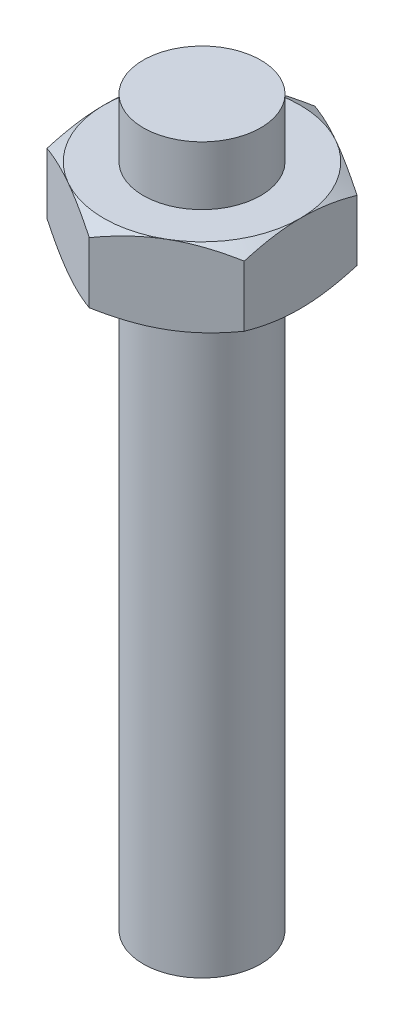
from build123d import *

# Parameters (mm, degrees)
BOSS_EXTRUDE1_DEPTH = 4
SKETCH2_OUTSIDE_W   = 29.082
SKETCH2_OUTSIDE_H   = 30.606
SKETCH2_OUTSIDE_R   = 5.014305997
CUT_EXTRUDE1_DEPTH  = 4
CUT_EXTRUDE1_DRAFT  = -60
SKETCH3_OUTSIDE_W   = 29.082
SKETCH3_OUTSIDE_H   = 30.606
SKETCH3_OUTSIDE_R   = 5.014305997
CUT_EXTRUDE2_DEPTH  = 4
CUT_EXTRUDE2_DRAFT  = -60
SKETCH4_R           = 3
BOSS_EXTRUDE3_DEPTH = 3
BOSS_EXTRUDE4_START = 30
SKETCH5_R           = 3
BOSS_EXTRUDE4_DEPTH = 30


with BuildPart() as part:
    # Sketch1 → Boss-Extrude1 (new body)
    with BuildSketch(Plane(origin=(0, 0, 0), x_dir=(1, 0, 0), z_dir=(0, 1, 0))):
        Polygon((5, 2.919649438), (-0.028490583, 5.789951738), (-5.028490583, 2.8703023), (-5, -2.919649438), (0.028490583, -5.789951738), (5.028490583, -2.8703023), align=None)
    extrude(amount=BOSS_EXTRUDE1_DEPTH)


with BuildPart() as cut_extrude1_tool:
    # Sketch2 outside → Cut-Extrude1 (with draft: the straight prism first)
    with BuildSketch(Plane(origin=(0, 4, 0), x_dir=(1, 0, 0), z_dir=(0, 1, 0))):
        Rectangle(SKETCH2_OUTSIDE_W, SKETCH2_OUTSIDE_H)
        Circle(SKETCH2_OUTSIDE_R, mode=Mode.SUBTRACT)
    extrude(amount=-CUT_EXTRUDE1_DEPTH)
    # Cut-Extrude1: the draft: its side faces are tilted about the plane it starts from
    cut_extrude1_sides = [cut_extrude1_tool.faces().sort_by_distance(p)[0] for p in [
        (0, 2, 15.303),
        (14.541, 2, 0),
        (0, 2, -15.303),
        (-14.541, 2, 0),
        (-5.014305997, 2, 0),
    ]]
    draft(cut_extrude1_sides, Plane(origin=(0, 4, 0), x_dir=(1, 0, 0), z_dir=(0, 1, 0)), CUT_EXTRUDE1_DRAFT)


with BuildPart() as part_1:
    add(part.part)

    # Cut-Extrude1: cut by cut_extrude1_tool
    add(cut_extrude1_tool.part, mode=Mode.SUBTRACT)


with BuildPart() as cut_extrude2_tool:
    # Sketch3 outside → Cut-Extrude2 (with draft: the straight prism first)
    with BuildSketch(Plane.XZ):
        Rectangle(SKETCH3_OUTSIDE_W, SKETCH3_OUTSIDE_H)
        Circle(SKETCH3_OUTSIDE_R, mode=Mode.SUBTRACT)
    extrude(amount=-CUT_EXTRUDE2_DEPTH)
    # Cut-Extrude2: the draft: its side faces are tilted about the plane it starts from
    cut_extrude2_sides = [cut_extrude2_tool.faces().sort_by_distance(p)[0] for p in [
        (0, 2, -15.303),
        (14.541, 2, 0),
        (0, 2, 15.303),
        (-14.541, 2, 0),
        (-5.014305997, 2, 0),
    ]]
    draft(cut_extrude2_sides, Plane.XZ, CUT_EXTRUDE2_DRAFT)


with BuildPart() as part_2:
    add(part_1.part)

    # Cut-Extrude2: cut by cut_extrude2_tool
    add(cut_extrude2_tool.part, mode=Mode.SUBTRACT)

    # Sketch4 → Boss-Extrude3 (add)
    with BuildSketch(Plane(origin=(0, 4, 0), x_dir=(1, 0, 0), z_dir=(0, 1, 0))):
        with Locations(Location((0, 0, 0), (0, 0, 270))):
            Circle(SKETCH4_R)
    extrude(amount=BOSS_EXTRUDE3_DEPTH)

    # Sketch5 → Boss-Extrude4 (add)
    with BuildSketch(Plane.XZ.offset(BOSS_EXTRUDE4_START)):
        with Locations(Location((0, 0, 0), (0, 0, 90))):
            Circle(SKETCH5_R)
    extrude(amount=-BOSS_EXTRUDE4_DEPTH)


solid = part_2.part
